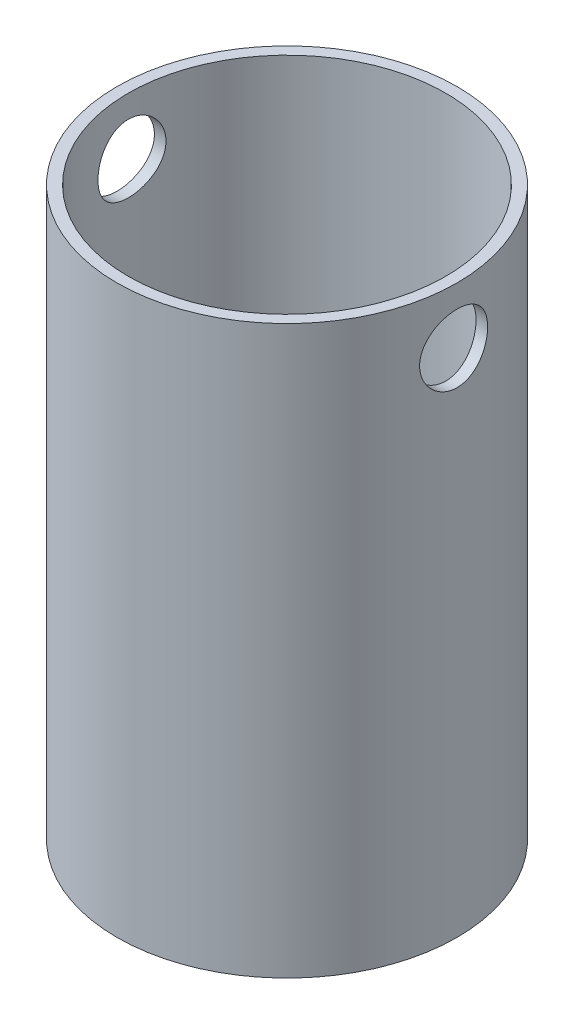
from build123d import *

# Parameters (mm, degrees)
SKETCH1_R           = 15
SKETCH1_R_2         = 14
BOSS_EXTRUDE1_DEPTH = 50
SKETCH2_R           = 3
CUT_EXTRUDE1_DEPTH  = 15


with BuildPart() as part:
    # Sketch1 → Boss-Extrude1 (new body)
    with BuildSketch(Plane(origin=(0, 0, 0), x_dir=(1, 0, 0), z_dir=(0, 1, 0))):
        with Locations(Location((0, 0, 0), (0, 0, 270))):
            Circle(SKETCH1_R)
        with Locations(Location((0, 0, 0), (0, 0, 270))):
            Circle(SKETCH1_R_2, mode=Mode.SUBTRACT)
    extrude(amount=BOSS_EXTRUDE1_DEPTH)

    # Sketch2 → Cut-Extrude1 (cut, symmetric)
    with BuildSketch(Plane(origin=(0, 0, 0), x_dir=(0, 0, -1), z_dir=(1, 0, 0))):
        with Locations((0, 45)):
            Circle(SKETCH2_R)
    extrude(amount=CUT_EXTRUDE1_DEPTH, both=True, mode=Mode.SUBTRACT)


solid = part.part
